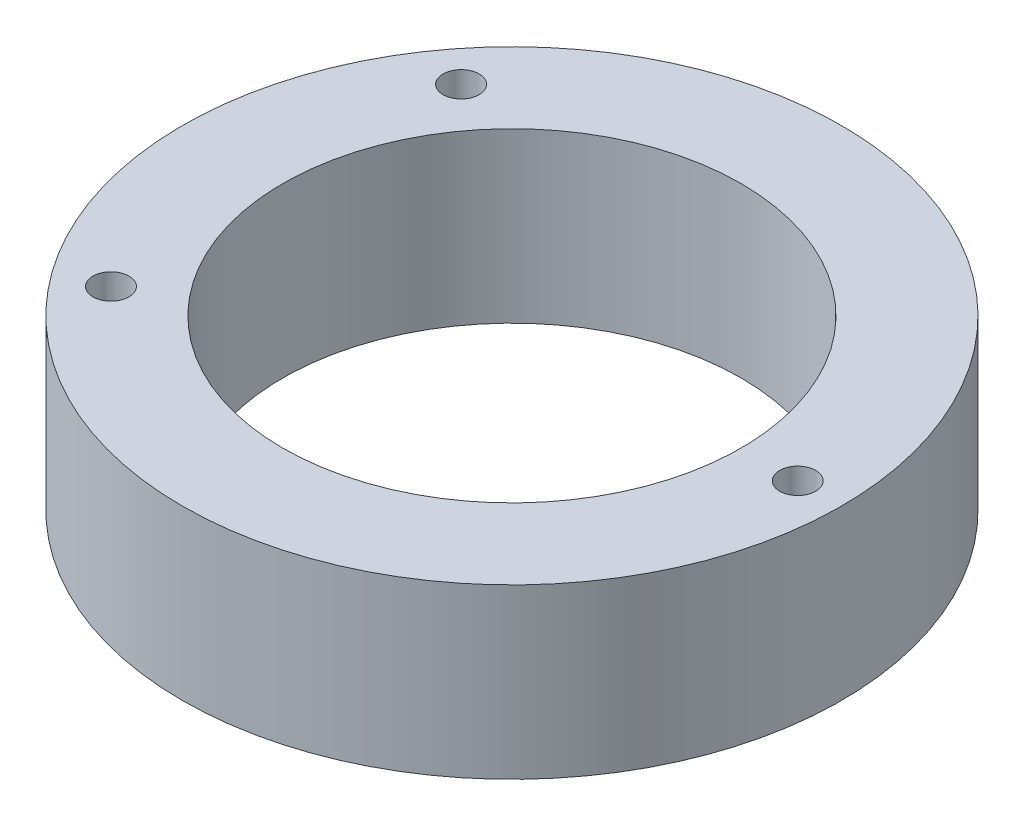
from build123d import *

# Parameters (mm, degrees)
SKETCH1_R           = 32
SKETCH1_R_2         = 22.25
SKETCH1_R_3         = 1.75
BOSS_EXTRUDE1_DEPTH = 16.35


with BuildPart() as part:
    # Sketch1 → Boss-Extrude1 (new body)
    with BuildSketch(Plane(origin=(0, 0, 0), x_dir=(1, 0, 0), z_dir=(0, 1, 0))):
        with Locations(Location((0, 0, 0), (0, 0, 270))):
            Circle(SKETCH1_R)
        with Locations(Location((0, 0, 0), (0, 0, 270))):
            Circle(SKETCH1_R_2, mode=Mode.SUBTRACT)
        with Locations(Location((-21.932737229, 17.000515805, 0), (0, 0, 270))):
            Circle(SKETCH1_R_3, mode=Mode.SUBTRACT)
        with Locations(Location((-21.932737229, -17.000515805, 0), (0, 0, 270))):
            Circle(SKETCH1_R_3, mode=Mode.SUBTRACT)
        with Locations(Location((27.75, 0, 0), (0, 0, 270))):
            Circle(SKETCH1_R_3, mode=Mode.SUBTRACT)
    extrude(amount=BOSS_EXTRUDE1_DEPTH)


solid = part.part
